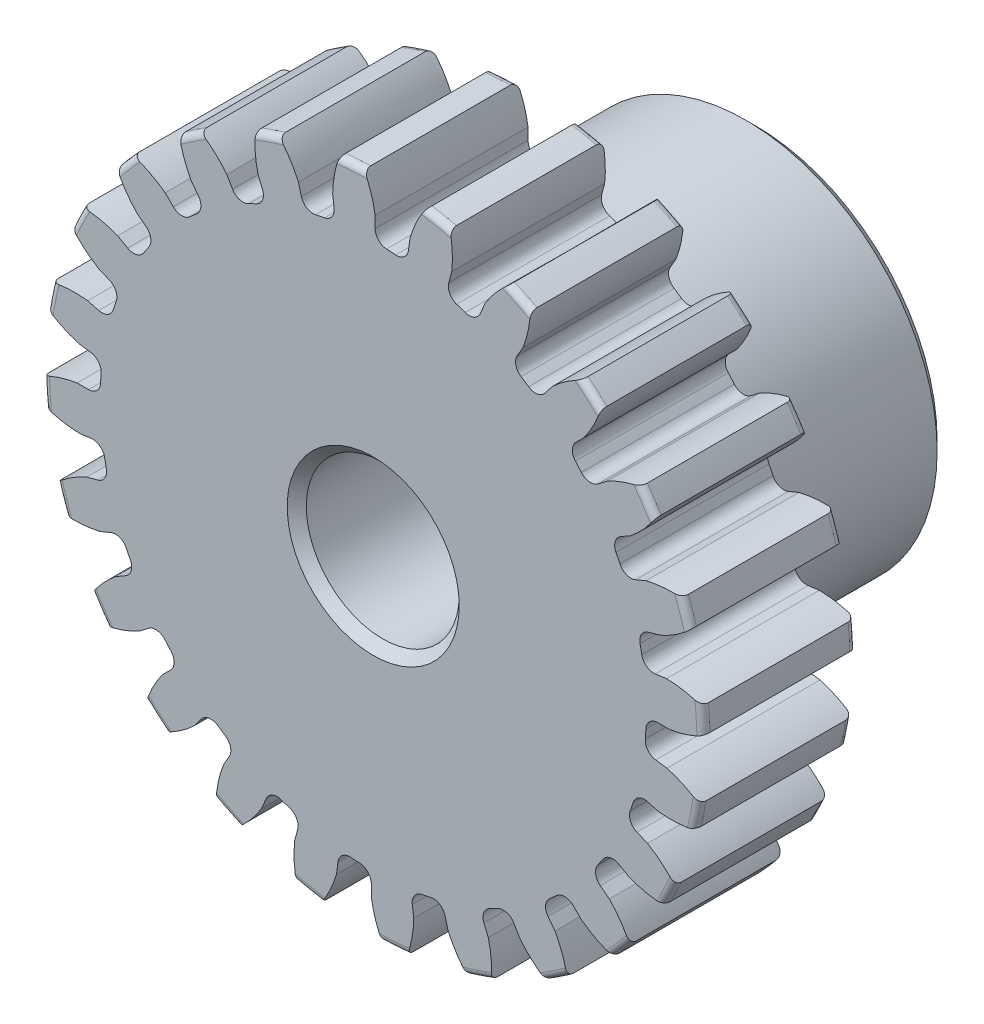
from build123d import *

# Parameters (mm, degrees)
SKETCH1_R                = 13.716
BOSS_EXTRUDE1_DEPTH      = 6.35
SKETCH2_W                = 9.525
SKETCH2_H                = 7.9375
FILLET2_R                = 0.27432
CUT_EXTRUDE1_DEPTH       = 26.065373376
FILLET1_R                = 0.498729
CIRPATTERN1_COUNT        = 24
FILLET1_OF_CIRPATTERN1_R = 0.498729
SKETCH5_R                = 3.175
CUT_EXTRUDE2_DEPTH       = 26.059640949
CHAMFER1_SIZE            = 0.396875


with BuildPart() as part:
    # Sketch1 → Boss-Extrude1 (new body)
    with BuildSketch(Plane.XY):
        Circle(SKETCH1_R)
    extrude(amount=-BOSS_EXTRUDE1_DEPTH)

    # Sketch2 → Revolve1 (revolve)
    with BuildSketch(Plane(origin=(0, 0, 0), x_dir=(0, 0, -1), z_dir=(1, 0, 0)), mode=Mode.PRIVATE) as revolve1_sk:
        with Locations((11.1125, 3.96875)):
            Rectangle(SKETCH2_W, SKETCH2_H)
    revolve(revolve1_sk.sketch.rotate(Axis((0, 0, -6.35), (0, 0, -1)), 90), axis=Axis((0, 0, -6.35), (0, 0, -1)))

    # Fillet2
    fillet2_edges = [part.edges().sort_by_distance(p)[0] for p in [
        (-13.716, 0, 0),
        (-13.716, 0, -6.35),
        (-7.9375, 0, -6.35),
    ]]
    fillet(fillet2_edges, radius=FILLET2_R)

    # Sketch4 → Cut-Extrude1 (cut, through all)
    with BuildSketch(Plane.XY):
        with BuildLine():
            Line((0.079822856, 12.295215923), (0.079822856, 11.334468928))
            ThreePointArc((0.079822856, 11.334468928), (0.74132985, 11.310481317), (1.400308553, 11.24791952))
            Line((1.400308553, 11.24791952), (1.525711492, 12.200447153))
            add(Edge.make_bspline(
                [(3.202922563, 14.63543046), (1.93922524, 13.63065019), (1.525711492, 12.200447153)],
                knots=[0, 0, 0, 1, 1, 1], degree=2))
            ThreePointArc((3.202922563, 14.63543046), (0.97985934, 14.949729542), (-1.265209537, 14.928287997))
            add(Edge.make_bspline(
                [(-1.265209537, 14.928287997), (-0.143473818, 13.767157818), (0.079822856, 12.295215923)],
                knots=[0, 0, 0, 1, 1, 1], degree=2))
        make_face()
    cut_extrude1 = extrude(amount=-CUT_EXTRUDE1_DEPTH, mode=Mode.SUBTRACT)

    # Fillet1
    fillet1_edges = [part.edges().sort_by_distance(p)[0] for p in [
        (1.400308553, 11.24791952, -3.175),
        (0.079822856, 11.334468928, -3.175),
    ]]
    fillet(fillet1_edges, radius=FILLET1_R)

    # CirPattern1: Cut-Extrude1 ×24 about axis
    cirpattern1_axis = Axis((0, 0, -6.35), (0, 0, 1))
    for i in range(1, CIRPATTERN1_COUNT):
        add(cut_extrude1.rotate(cirpattern1_axis, i * 360 / CIRPATTERN1_COUNT), mode=Mode.SUBTRACT)

    # Fillet1 of CirPattern1
    fillet1_of_cirpattern1_edges = [part.edges().sort_by_distance(p)[0] for p in [
        (-1.558581593, 11.227082479, -3.175),
        (-2.856473467, 10.96891594, -3.175),
        (-4.41125698, 10.44113832, -3.175),
        (-5.598105843, 9.855849458, -3.175),
        (-6.963312493, 8.94364784, -3.175),
        (-7.958236558, 8.071123122, -3.175),
        (-9.040829767, 6.83666254, -3.175),
        (-9.776026602, 5.736363085, -3.175),
        (-10.502229433, 4.263769986, -3.175),
        (-10.927596589, 3.010679382, -3.175),
        (-11.24791952, 1.400308553, -3.175),
        (-11.334468928, 0.079822856, -3.175),
        (-11.227082479, -1.558581593, -3.175),
        (-10.96891594, -2.856473467, -3.175),
        (-10.44113832, -4.41125698, -3.175),
        (-9.855849458, -5.598105843, -3.175),
        (-8.94364784, -6.963312493, -3.175),
        (-8.071123122, -7.958236558, -3.175),
        (-6.83666254, -9.040829767, -3.175),
        (-5.736363085, -9.776026602, -3.175),
        (-4.263769986, -10.502229433, -3.175),
        (-3.010679382, -10.927596589, -3.175),
        (-1.400308553, -11.24791952, -3.175),
        (-0.079822856, -11.334468928, -3.175),
        (1.558581593, -11.227082479, -3.175),
        (2.856473467, -10.96891594, -3.175),
        (4.41125698, -10.44113832, -3.175),
        (5.598105843, -9.855849458, -3.175),
        (6.963312493, -8.94364784, -3.175),
        (7.958236558, -8.071123122, -3.175),
        (9.040829767, -6.83666254, -3.175),
        (9.776026602, -5.736363085, -3.175),
        (10.502229433, -4.263769986, -3.175),
        (10.927596589, -3.010679382, -3.175),
        (11.24791952, -1.400308553, -3.175),
        (11.334468928, -0.079822856, -3.175),
        (11.227082479, 1.558581593, -3.175),
        (10.96891594, 2.856473467, -3.175),
        (10.44113832, 4.41125698, -3.175),
        (9.855849458, 5.598105843, -3.175),
        (8.94364784, 6.963312493, -3.175),
        (8.071123122, 7.958236558, -3.175),
        (6.83666254, 9.040829767, -3.175),
        (5.736363085, 9.776026602, -3.175),
        (4.263769986, 10.502229433, -3.175),
        (3.010679382, 10.927596589, -3.175),
    ]]
    fillet(fillet1_of_cirpattern1_edges, radius=FILLET1_OF_CIRPATTERN1_R)

    # Sketch5 → Cut-Extrude2 (cut, through all)
    with BuildSketch(Plane.XY):
        Circle(SKETCH5_R)
    extrude(amount=-CUT_EXTRUDE2_DEPTH, mode=Mode.SUBTRACT)

    # Chamfer1
    chamfer1_edges = [part.edges().sort_by_distance(p)[0] for p in [
        (-3.175, 0, -15.875),
        (-3.175, 0, 0),
        (-7.9375, 0, -15.875),
    ]]
    chamfer(chamfer1_edges, length=CHAMFER1_SIZE)


solid = part.part
